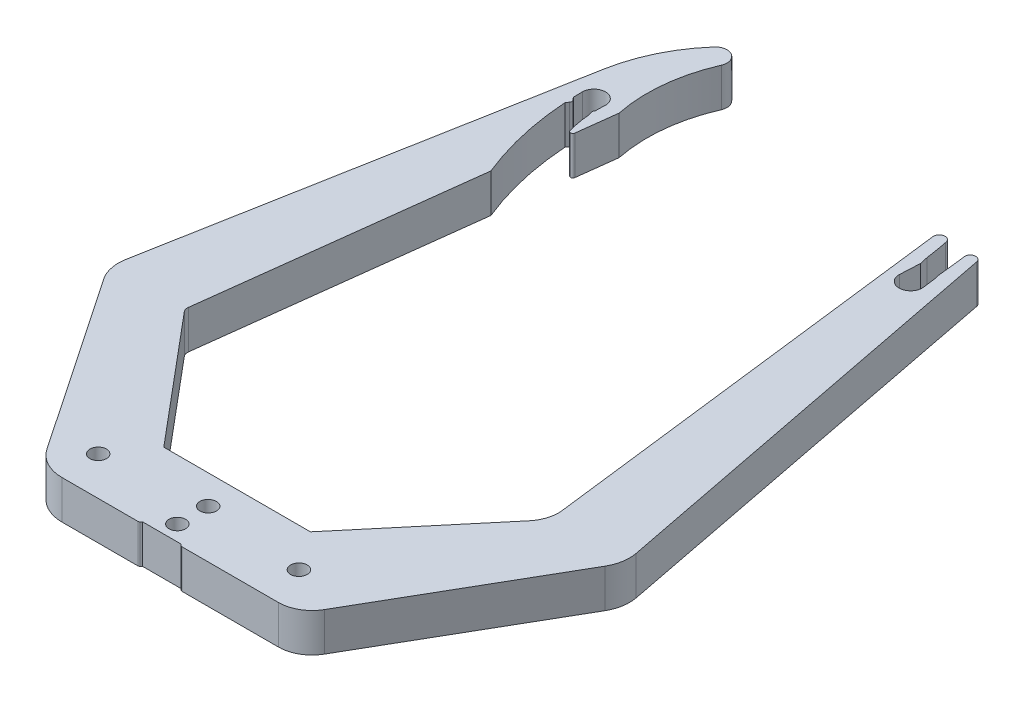
from build123d import *

# Parameters (mm, degrees)
EXTRUDE_1_DEPTH     = 10
CUT_EXTRUDE_1_REACH = 177.427
SKETCH_2_R          = 2.15
FILLET_1_R          = 0.6


with BuildPart() as part:
    # 草图1 → 凸台-拉伸1 (new body)
    with BuildSketch(Plane(origin=(0, 0, 0), x_dir=(1, 0, 0), z_dir=(0, 1, 0))):
        with BuildLine():
            Line((-19, 0), (19, 0))
            Line((19, 0), (44.854614973, 30.81233028))
            ThreePointArc((44.854614973, 30.81233028), (46.529317931, 33.929104052), (46.82231051, 37.455159084))
            Line((46.82231051, 37.455159084), (33.389549678, 146.856216784))
            ThreePointArc((33.389549678, 146.856216784), (34.753999407, 148.533855984), (36.376927445, 147.104765038))
            ThreePointArc((36.376927445, 147.104765038), (36.892496808, 144.296291333), (37.320815542, 141.473193853))
            Line((37.320815542, 141.473193853), (37.815132232, 139.258398169))
            ThreePointArc((37.815132232, 139.258398169), (37.817176658, 139.245056143), (37.817405692, 139.231560332))
            Line((37.817405692, 139.231560332), (37.557917484, 134.104765038))
            ThreePointArc((37.557917484, 134.104765038), (40.754926912, 130.959847465), (43.503129215, 134.503681536))
            Line((43.503129215, 134.503681536), (43.077003941, 137.813685213))
            Line((43.077003941, 137.813685213), (42.807637334, 138.925557366))
            ThreePointArc((42.807637334, 138.925557366), (42.806315787, 138.931905108), (42.80540838, 138.938325149))
            Line((42.80540838, 138.938325149), (42.129277547, 145.175318139))
            Line((42.129277547, 145.175318139), (41.965181023, 146.44996701))
            ThreePointArc((41.965181023, 146.44996701), (43.130662006, 148.010841711), (44.727999785, 146.895858405))
            Line((44.727999785, 146.895858405), (66.016482503, 37.376109146))
            ThreePointArc((66.016482503, 37.376109146), (66.063066684, 33.817543133), (64.860464706, 30.468019192))
            Line((64.860464706, 30.468019192), (38.23055697, -15.656334008))
            ThreePointArc((38.23055697, -15.656334008), (35.050772773, -18.836118205), (30.707106781, -20))
            Line((30.707106781, -20), (5.707106781, -20))
            ThreePointArc((5.707106781, -20), (5.515765065, -19.961939766), (5.353553391, -19.853553391))
            Line((5.353553391, -19.853553391), (5, -19.5))
            Line((5, -19.5), (-5, -19.5))
            Line((-5, -19.5), (-5.353553391, -19.853553391))
            ThreePointArc((-5.353553391, -19.853553391), (-5.515765065, -19.961939766), (-5.707106781, -20))
            Line((-5.707106781, -20), (-25.399802658, -20))
            ThreePointArc((-25.399802658, -20), (-30.087775174, -18.833058003), (-33.681629288, -15.604582738))
            Line((-33.681629288, -15.604582738), (-64.860464706, 30.468019192))
            ThreePointArc((-64.860464706, 30.468019192), (-66.063066684, 33.817543133), (-66.016482503, 37.376109146))
            Line((-66.016482503, 37.376109146), (-46.829620455, 141.890886738))
            ThreePointArc((-46.829620455, 141.890886738), (-43.465252598, 152.148967586), (-37.480163066, 161.13372674))
            ThreePointArc((-37.480163066, 161.13372674), (-33.620696298, 161.680216975), (-32.479267504, 157.953116813))
            ThreePointArc((-32.479267504, 157.953116813), (-35.579400499, 146.14570295), (-34.973851142, 133.953116813))
            Line((-34.973851142, 133.953116813), (-47.176674229, 34.569098196))
            ThreePointArc((-47.176674229, 34.569098196), (-47.109221395, 33.75732882), (-46.723670812, 33.03978429))
            Line((-46.723670812, 33.03978429), (-19, 0))
        make_face()
    extrude(amount=EXTRUDE_1_DEPTH)

    # 草图2 → 切除-拉伸1 (cut, up to next)
    with BuildSketch(Plane(origin=(0, 10, 0), x_dir=(1, 0, 0), z_dir=(0, 1, 0)), mode=Mode.PRIVATE) as cut_extrude_1_sk1:
        with Locations(Location((0, -15.5, 0), (0, 0, 270))):
            Circle(SKETCH_2_R)
    cut_extrude_1_tool1 = extrude(cut_extrude_1_sk1.sketch, amount=-CUT_EXTRUDE_1_REACH, mode=Mode.PRIVATE) & part.part
    # 草图2 → 切除-拉伸1 (cut, up to next)
    with BuildSketch(Plane(origin=(0, 10, 0), x_dir=(1, 0, 0), z_dir=(0, 1, 0)), mode=Mode.PRIVATE) as cut_extrude_1_sk2:
        with Locations(Location((0, -7.5, 0), (0, 0, 270))):
            Circle(SKETCH_2_R)
    cut_extrude_1_tool2 = extrude(cut_extrude_1_sk2.sketch, amount=-CUT_EXTRUDE_1_REACH, mode=Mode.PRIVATE) & part.part
    # 草图2 → 切除-拉伸1 (cut, up to next)
    with BuildSketch(Plane(origin=(0, 10, 0), x_dir=(1, 0, 0), z_dir=(0, 1, 0)), mode=Mode.PRIVATE) as cut_extrude_1_sk3:
        with Locations(Location((-26, -10, 0), (0, 0, 270))):
            Circle(SKETCH_2_R)
    cut_extrude_1_tool3 = extrude(cut_extrude_1_sk3.sketch, amount=-CUT_EXTRUDE_1_REACH, mode=Mode.PRIVATE) & part.part
    # 草图2 → 切除-拉伸1 (cut, up to next)
    with BuildSketch(Plane(origin=(0, 10, 0), x_dir=(1, 0, 0), z_dir=(0, 1, 0)), mode=Mode.PRIVATE) as cut_extrude_1_sk4:
        with Locations(Location((26, -10, 0), (0, 0, 270))):
            Circle(SKETCH_2_R)
    cut_extrude_1_tool4 = extrude(cut_extrude_1_sk4.sketch, amount=-CUT_EXTRUDE_1_REACH, mode=Mode.PRIVATE) & part.part
    # 草图2 → 切除-拉伸1 (cut, up to next)
    with BuildSketch(Plane(origin=(0, 10, 0), x_dir=(1, 0, 0), z_dir=(0, 1, 0)), mode=Mode.PRIVATE) as cut_extrude_1_sk5:
        with BuildLine():
            Line((-36.549558395, 121.120011078), (-38.607748185, 104.35740041))
            ThreePointArc((-38.607748185, 104.35740041), (-42.47341142, 116.594845153), (-44.332546284, 129.292956179))
            Line((-44.332546284, 129.292956179), (-43.845113062, 129.987442667))
            ThreePointArc((-43.845113062, 129.987442667), (-43.702378092, 130.509625408), (-43.924830211, 131.003146575))
            Line((-43.924830211, 131.003146575), (-44.447419993, 131.543571067))
            ThreePointArc((-44.447419993, 131.543571067), (-44.482588605, 132.737575539), (-44.499925482, 133.931972015))
            ThreePointArc((-44.499925482, 133.931972015), (-41.418283025, 136.952003662), (-38.505677682, 133.768634142))
            ThreePointArc((-38.505677682, 133.768634142), (-38.556072369, 132.542586282), (-38.556286633, 131.315503182))
            Line((-38.556286633, 131.315503182), (-38.546052546, 131.325051295))
            ThreePointArc((-38.546052546, 131.325051295), (-38.780683801, 130.91622187), (-38.744387532, 130.446247504))
            Line((-38.744387532, 130.446247504), (-38.486748585, 129.793872308))
            ThreePointArc((-38.486748585, 129.793872308), (-37.841140795, 125.384806825), (-36.549558395, 121.120011078))
        make_face()
    cut_extrude_1_tool5 = extrude(cut_extrude_1_sk5.sketch, amount=-CUT_EXTRUDE_1_REACH, mode=Mode.PRIVATE) & part.part
    add(cut_extrude_1_tool1.solids().sort_by_distance((0, 10, 15.5))[0], mode=Mode.SUBTRACT)
    add(cut_extrude_1_tool2.solids().sort_by_distance((0, 10, 7.5))[0], mode=Mode.SUBTRACT)
    add(cut_extrude_1_tool3.solids().sort_by_distance((-26, 10, 10))[0], mode=Mode.SUBTRACT)
    add(cut_extrude_1_tool4.solids().sort_by_distance((26, 10, 10))[0], mode=Mode.SUBTRACT)
    add(cut_extrude_1_tool5.solids().sort_by_distance((-40.502089, 10, -123.156617))[0], mode=Mode.SUBTRACT)

    # 圆角1
    fillet_1_edges = [part.edges().sort_by_distance(p)[0] for p in [
        (-36.549558395, 5, -121.120011078),
        (-34.973851142, 5, -133.953116813),
    ]]
    fillet(fillet_1_edges, radius=FILLET_1_R)


solid = part.part
